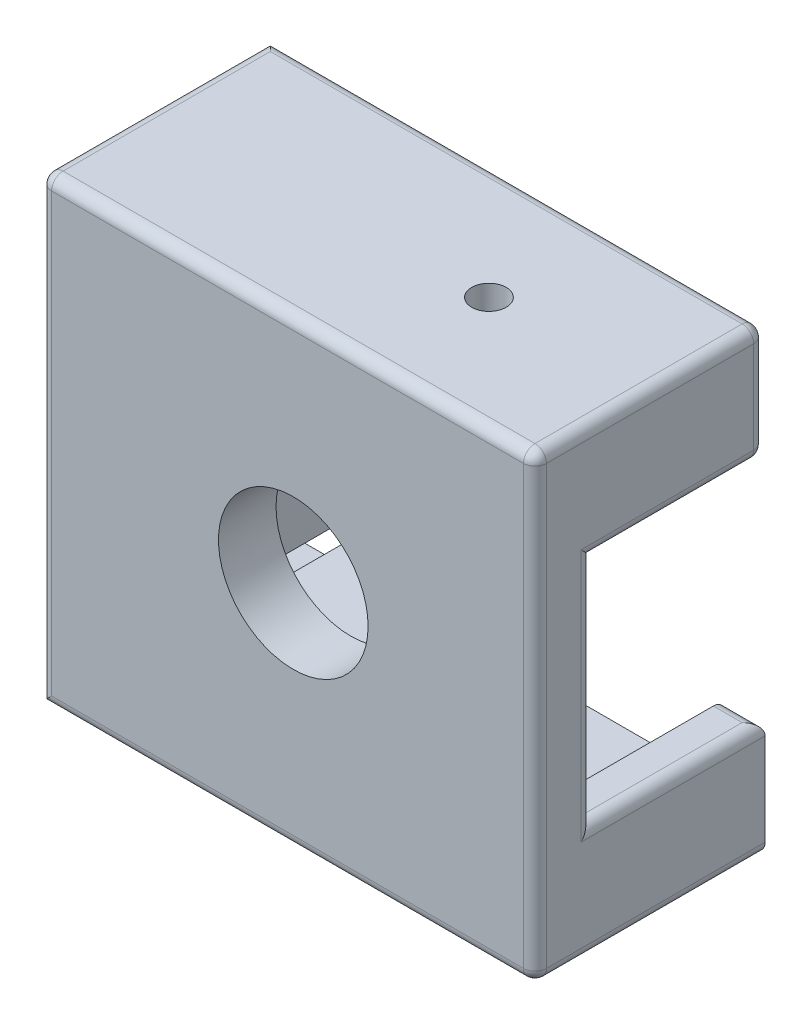
from build123d import *

# Parameters (mm, degrees)
SKETCH1_W           = 43
SKETCH1_H           = 40
BOSS_EXTRUDE1_DEPTH = 5
SKETCH2_W           = 13
SKETCH2_H           = 2
SKETCH2_W_2         = 17.5
SKETCH2_W_3         = 2.5
SKETCH2_H_2         = 10
BOSS_EXTRUDE3_DEPTH = 8
BOSS_EXTRUDE4_DEPTH = 15
SKETCH4_R           = 1.5
CUT_EXTRUDE1_DEPTH  = 65
SKETCH6_R           = 1.5
CUT_EXTRUDE2_DEPTH  = 10
SKETCH7_R           = 6.5
CUT_EXTRUDE3_DEPTH  = 20
SKETCH8_W           = 15
SKETCH8_H           = 20
CUT_EXTRUDE4_DEPTH  = 5
FILLET1_R           = 1
FILLET2_R           = 1


with BuildPart() as part:
    # Sketch1 → Boss-Extrude1 (new body)
    with BuildSketch(Plane.XY):
        with Locations((75.504805995, -8.785410368)):
            Rectangle(SKETCH1_W, SKETCH1_H)
    extrude(amount=BOSS_EXTRUDE1_DEPTH)

    # Sketch2 → Boss-Extrude3 (add)
    with BuildSketch(Plane(origin=(0, 0, 0), x_dir=(-1, 0, 0), z_dir=(0, 0, -1))):
        with Locations((-79.004805995, -0.485410368)):
            Rectangle(SKETCH2_W, SKETCH2_H)
        with Locations((-76.754805995, -16.985410368)):
            Rectangle(SKETCH2_W_2, SKETCH2_H)
        with Locations((-66.754805995, -9.285410368)):
            Rectangle(SKETCH2_W_3, SKETCH2_H_2)
    extrude(amount=BOSS_EXTRUDE3_DEPTH)

    # Sketch3 → Boss-Extrude4 (add)
    with BuildSketch(Plane(origin=(0, 0, 0), x_dir=(-1, 0, 0), z_dir=(0, 0, -1))):
        Polygon((-54.004805995, 11.214589632), (-97.004805995, 11.214589632), (-97.004805995, -28.785410368), (-54.004805995, -28.785410368), (-54.004805995, -25.285410368), (-93.504805995, -25.285410368), (-93.504805995, 7.714589632), (-54.004805995, 7.714589632), align=None)
    extrude(amount=BOSS_EXTRUDE4_DEPTH)

    # Sketch4 → Cut-Extrude1 (cut)
    with BuildSketch(Plane(origin=(0, 11.214589632, 0), x_dir=(1, 0, 0), z_dir=(0, 1, 0))):
        with Locations(Location((83.004805995, 5, 0), (0, 0, 180))):
            Circle(SKETCH4_R)
    extrude(amount=-CUT_EXTRUDE1_DEPTH, mode=Mode.SUBTRACT)

    # Sketch6 → Cut-Extrude2 (cut)
    with BuildSketch(Plane.XZ.offset(28.785410368)):
        with Locations((60.004805995, -5)):
            Circle(SKETCH6_R)
    extrude(amount=-CUT_EXTRUDE2_DEPTH, mode=Mode.SUBTRACT)

    # Sketch7 → Cut-Extrude3 (cut)
    with BuildSketch(Plane.XY.offset(5)):
        with Locations((76.004805995, -8.785410368)):
            Circle(SKETCH7_R)
    extrude(amount=-CUT_EXTRUDE3_DEPTH, mode=Mode.SUBTRACT)

    # Sketch8 → Cut-Extrude4 (cut)
    with BuildSketch(Plane(origin=(97.004805995, 0, 0), x_dir=(0, 0, -1), z_dir=(1, 0, 0))):
        with Locations((7.5, -8.785410368)):
            Rectangle(SKETCH8_W, SKETCH8_H)
    extrude(amount=-CUT_EXTRUDE4_DEPTH, mode=Mode.SUBTRACT)

    # Fillet1
    fillet1_edges = [part.edges().sort_by_distance(p)[0] for p in [
        (54.004805995, 11.214589632, -5),
        (54.004805995, -8.785410368, 5),
        (75.504805995, -28.785410368, 5),
        (97.004805995, -28.785410368, -5),
        (97.004805995, -8.785410368, 5),
        (75.504805995, 11.214589632, 5),
        (97.004805995, 11.214589632, -5),
        (97.004805995, 6.214589632, -15),
        (75.504805995, 11.214589632, -15),
    ]]
    fillet(fillet1_edges, radius=FILLET1_R)

    # Fillet2
    fillet2_edges = [part.edges().sort_by_distance(p)[0] for p in [
        (94.754805995, 1.214589632, -15),
        (95.254805995, -18.785410368, -15),
        (97.004805995, -8.785410368, 0),
        (97.004805995, -18.785410368, -7.5),
        (97.004805995, 1.214589632, -7),
        (96.711912776, 1.214589632, -14.707106781),
    ]]
    fillet(fillet2_edges, radius=FILLET2_R)


solid = part.part
